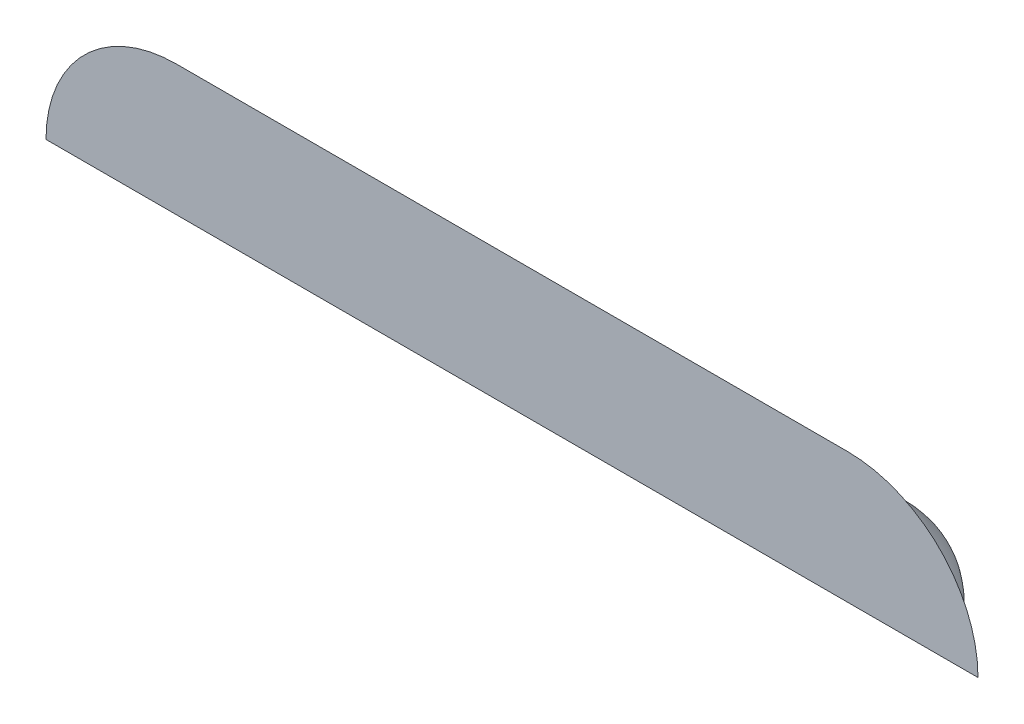
from build123d import *

# Parameters (mm, degrees)
SKETCH1_W           = 150
SKETCH1_H           = 150
BOSS_EXTRUDE1_DEPTH = 10
BOSS_EXTRUDE2_START = -30
BOSS_EXTRUDE2_DEPTH = 65
REVOLVE2_ANGLE      = 90
REVOLVE3_ANGLE      = 90
FILLET1_R           = 6
SKETCH12_W          = 150
SKETCH12_H          = 10
CUT_EXTRUDE1_DEPTH  = 209.573461212


with BuildPart() as part:
    # Sketch1 → Boss-Extrude1 (new body)
    with BuildSketch(Plane.XY):
        with Locations((-69.578313253, -0.451807229)):
            Rectangle(SKETCH1_W, SKETCH1_H)
    extrude(amount=BOSS_EXTRUDE1_DEPTH)

    # Sketch3 → Boss-Extrude2 (add)
    with BuildSketch(Plane.ZY.offset(144.578313253).offset(BOSS_EXTRUDE2_START)):
        with BuildLine():
            Line((0, 8), (0, 0))
            Line((0, 0), (-8, 0))
            ThreePointArc((-8, 0), (-5.656854249, 5.656854249), (0, 8))
        make_face()
    extrude(amount=-BOSS_EXTRUDE2_DEPTH)

    # Sketch10 → Revolve2 (revolve)
    with BuildSketch(Plane.ZY.offset(114.578313253)):
        with BuildLine():
            Line((-8, 0), (0, 0))
            Line((0, 0), (0, 8))
            ThreePointArc((0, 8), (-5.656854249, 5.656854249), (-8, 0))
        make_face()
    revolve(axis=Axis((-114.578313253, 0, -8), (0, 0, 1)), revolution_arc=REVOLVE2_ANGLE)

    # Sketch11 → Revolve3 (revolve)
    with BuildSketch(Plane(origin=(-49.578313253, 0, 0), x_dir=(0, 0, -1), z_dir=(1, 0, 0))):
        with BuildLine():
            Line((0, 8), (0, 0))
            Line((0, 0), (8, 0))
            ThreePointArc((8, 0), (5.656854249, 5.656854249), (0, 8))
        make_face()
    revolve(axis=Axis((-49.578313253, 0, 0), (0, 0, -1)), revolution_arc=REVOLVE3_ANGLE)

    # Fillet1
    fillet1_edges = [part.edges().sort_by_distance(p)[0] for p in [
        (-82.078313253, 8, 0),
        (-120.235167503, 5.656854249, 0),
        (-43.921459004, 5.656854249, 0),
    ]]
    fillet(fillet1_edges, radius=FILLET1_R)

    # Sketch12 → Cut-Extrude1 (cut, through all)
    with BuildSketch(Plane.XZ.offset(75.451807229)):
        with Locations((-69.578313253, 5)):
            Rectangle(SKETCH12_W, SKETCH12_H)
    extrude(amount=-CUT_EXTRUDE1_DEPTH, mode=Mode.SUBTRACT)


solid = part.part
